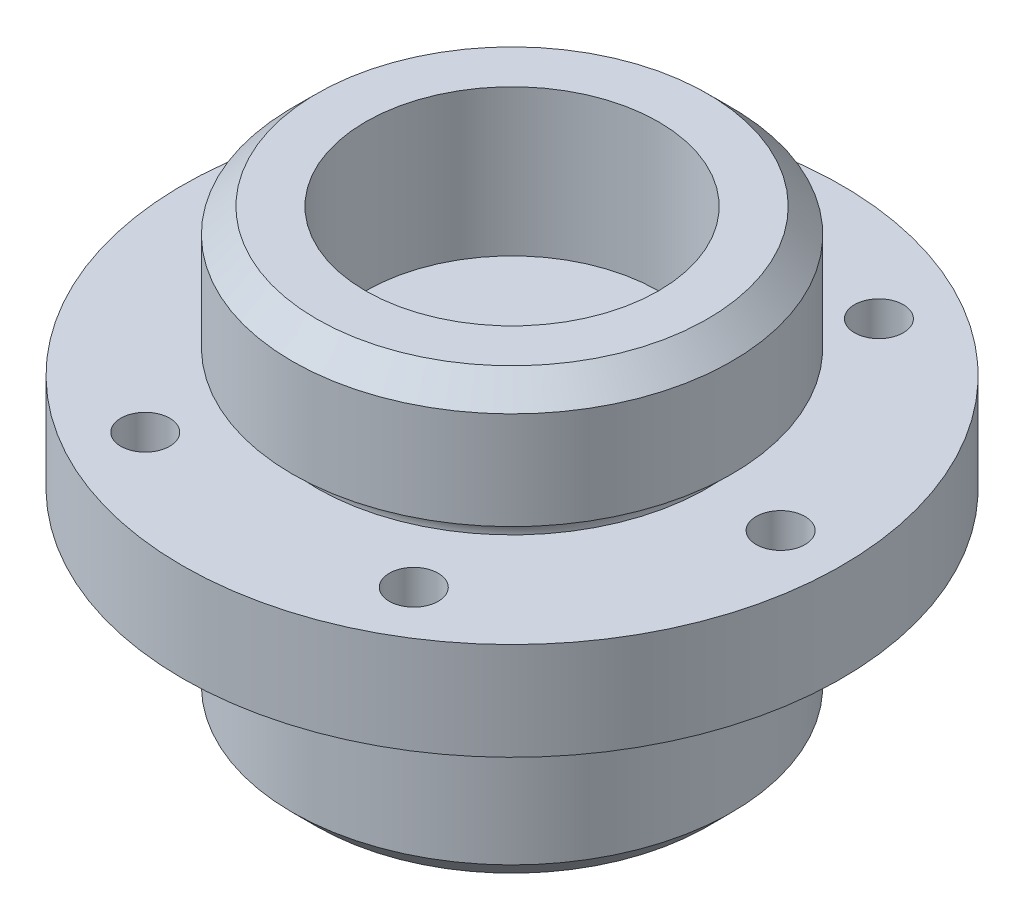
from build123d import *

# Parameters (mm, degrees)
Y_KSEKLIK_EKSTR_ZYON1_DEPTH      = 40
Y_KSEKLIK_EKSTR_ZYON1_DEPTH_BACK = 32
IZIM1_R                          = 36
IZIM1_R_2                        = 24
IZIM1_3_R                        = 54
Y_KSEKLIK_EKSTR_ZYON2_DEPTH      = 16
PAH1_SIZE                        = 4
PAH3_SIZE                        = 4
IZIM6_R                          = 4
KES_EKSTR_ZYON1_DEPTH            = 16


with BuildPart() as part:
    # Çizim1 → Yükseklik-Ekstrüzyon1 (new, two sides: drawn at the far end of the back side and taken through both)
    with BuildSketch(Plane(origin=(0, 0, 0), x_dir=(1, 0, 0), z_dir=(0, 1, 0)).offset(-Y_KSEKLIK_EKSTR_ZYON1_DEPTH_BACK)):
        Circle(IZIM1_R)
        Circle(IZIM1_R_2, mode=Mode.SUBTRACT)
    extrude(amount=Y_KSEKLIK_EKSTR_ZYON1_DEPTH + Y_KSEKLIK_EKSTR_ZYON1_DEPTH_BACK)

    # Çizim1<3> → Yükseklik-Ekstrüzyon2 (add)
    with BuildSketch(Plane(origin=(0, 0, 0), x_dir=(1, 0, 0), z_dir=(0, 1, 0))):
        Circle(IZIM1_3_R)
    extrude(amount=Y_KSEKLIK_EKSTR_ZYON2_DEPTH)

    # Pah1
    pah1_edges = [part.edges().sort_by_distance(p)[0] for p in [
        (-36, 40, 0),
    ]]
    chamfer(pah1_edges, length=PAH1_SIZE)

    # Pah3
    pah3_edges = [part.edges().sort_by_distance(p)[0] for p in [
        (-36, -32, 0),
    ]]
    chamfer(pah3_edges, length=PAH3_SIZE)

    # Kes-Süpür1: sweep along a curve in space
    with BuildLine() as kes_s_p_r1_path:
        ThreePointArc((0, 16, 36), (25.455844123, 16, 25.455844123), (36, 16, 0))
        ThreePointArc((36, 16, 0), (25.455844123, 16, -25.455844123), (0, 16, -36))
        ThreePointArc((0, 16, -36), (-25.455844123, 16, -25.455844123), (-36, 16, 0))
        ThreePointArc((-36, 16, 0), (-25.455844123, 16, 25.455844123), (0, 16, 36))
    # Çizim4 → Kes-Süpür1 (sweep, cut)
    with BuildSketch(Plane(origin=(0, 0, 0), x_dir=(0, 0, -1), z_dir=(1, 0, 0))):
        with BuildLine():
            Line((-36, 20), (-36, 16))
            Line((-36, 16), (-32, 16))
            ThreePointArc((-32, 16), (-33.171572875, 18.828427125), (-36, 20))
        make_face()
    sweep(path=kes_s_p_r1_path.line, mode=Mode.SUBTRACT)

    # Kes-Süpür3: sweep along a curve in space
    with BuildLine() as kes_s_p_r3_path:
        ThreePointArc((0, 0, 36), (25.455844123, 0, 25.455844123), (36, 0, 0))
        ThreePointArc((36, 0, 0), (25.455844123, 0, -25.455844123), (0, 0, -36))
        ThreePointArc((0, 0, -36), (-25.455844123, 0, -25.455844123), (-36, 0, 0))
        ThreePointArc((-36, 0, 0), (-25.455844123, 0, 25.455844123), (0, 0, 36))
    # Çizim5 → Kes-Süpür3 (sweep, cut)
    with BuildSketch(Plane(origin=(0, 0, 0), x_dir=(0, 0, -1), z_dir=(1, 0, 0))):
        with BuildLine():
            Line((-36, 0), (-36, -4))
            ThreePointArc((-36, -4), (-33.171572875, -2.828427125), (-32, 0))
            Line((-32, 0), (-36, 0))
        make_face()
    sweep(path=kes_s_p_r3_path.line, mode=Mode.SUBTRACT)

    # Çizim6 → Kes-Ekstrüzyon1 (cut)
    with BuildSketch(Plane(origin=(0, 16, 0), x_dir=(1, 0, 0), z_dir=(0, 1, 0))):
        with Locations((-22, 38.105117767)):
            Circle(IZIM6_R)
        with Locations((22, 38.105117767)):
            Circle(IZIM6_R)
        with Locations((44, 0)):
            Circle(IZIM6_R)
        with Locations((22, -38.105117767)):
            Circle(IZIM6_R)
        with Locations((-22, -38.105117767)):
            Circle(IZIM6_R)
        with Locations((-44, 0)):
            Circle(IZIM6_R)
    extrude(amount=-KES_EKSTR_ZYON1_DEPTH, mode=Mode.SUBTRACT)


solid = part.part
